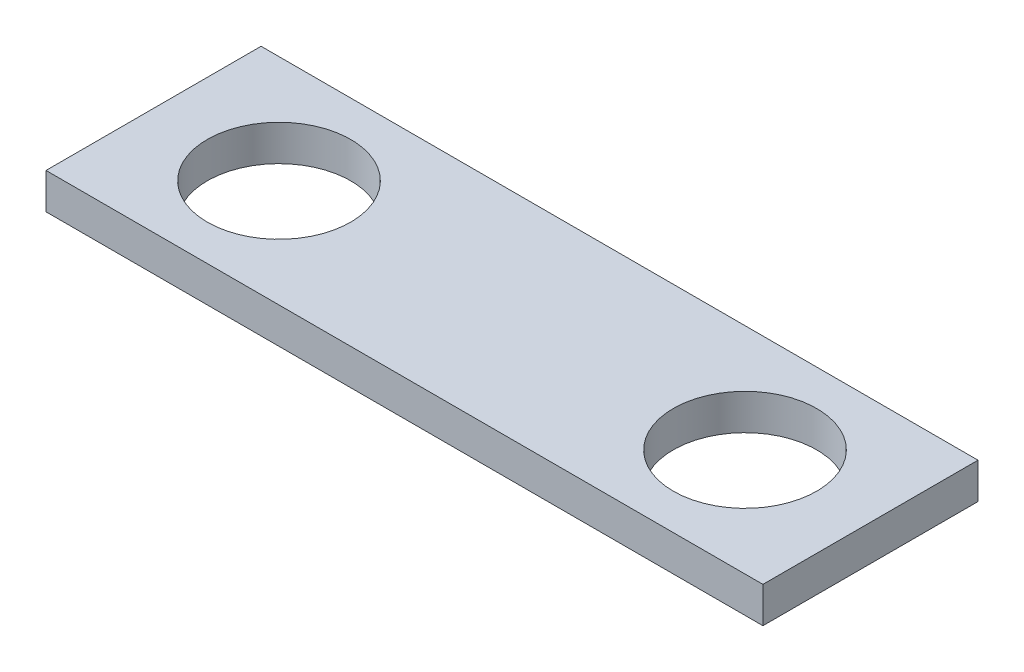
from build123d import *

# Parameters (mm, degrees)
SKETCH1_W           = 40
SKETCH1_H           = 12
BOSS_EXTRUDE1_DEPTH = 2
SKETCH2_R           = 4
CUT_EXTRUDE3_DEPTH  = 42.809089921


with BuildPart() as part:
    # Sketch1 → Boss-Extrude1 (new body)
    with BuildSketch(Plane(origin=(0, 0, 0), x_dir=(1, 0, 0), z_dir=(0, 1, 0))):
        with Locations((20, 6)):
            Rectangle(SKETCH1_W, SKETCH1_H)
    extrude(amount=BOSS_EXTRUDE1_DEPTH)

    # Sketch2 → Cut-Extrude3 (cut, through all)
    with BuildSketch(Plane(origin=(0, 2, 0), x_dir=(1, 0, 0), z_dir=(0, 1, 0))):
        with Locations(Location((7, 6, 0), (0, 0, 270))):
            Circle(SKETCH2_R)
        with Locations(Location((33, 6, 0), (0, 0, 270))):
            Circle(SKETCH2_R)
    extrude(amount=-CUT_EXTRUDE3_DEPTH, mode=Mode.SUBTRACT)


solid = part.part
